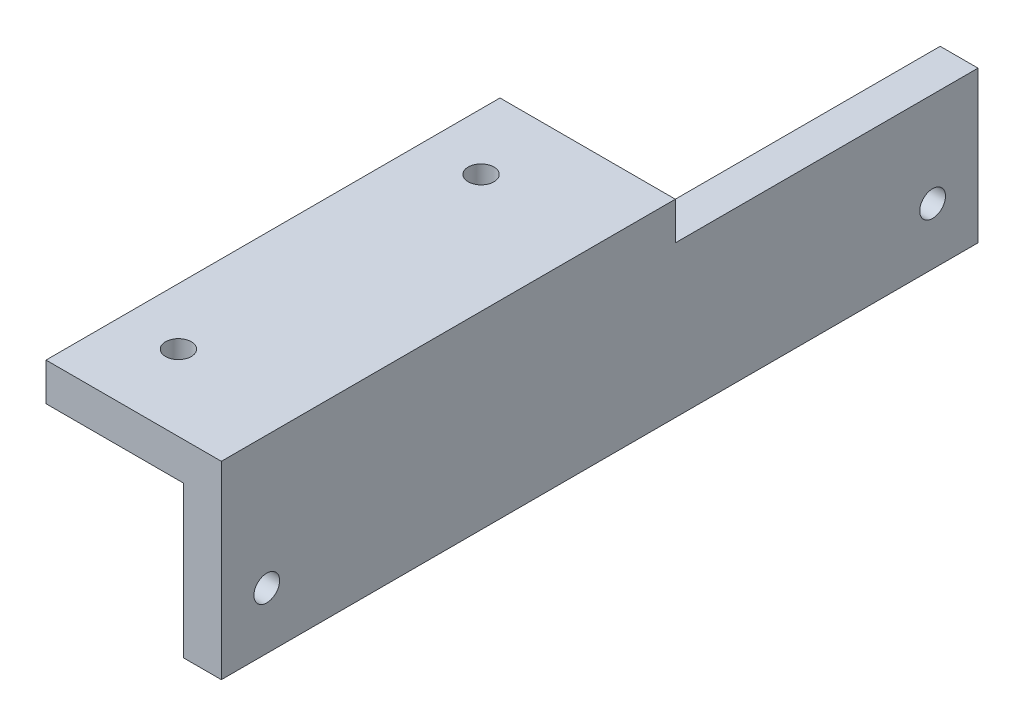
from build123d import *

# Parameters (mm, degrees)
SKETCH1_W           = 100
SKETCH1_H           = 20
SKETCH1_R           = 1.7
BOSS_EXTRUDE1_DEPTH = 2.5
SKETCH1_3_W         = 100
SKETCH1_3_H         = 20
BOSS_EXTRUDE2_DEPTH = 2.5
SKETCH2_W           = 23.175
SKETCH2_H           = 60
SKETCH2_R           = 1.7
BOSS_EXTRUDE3_DEPTH = 5


with BuildPart() as part:
    # Sketch1 → Boss-Extrude1 (new body)
    with BuildSketch(Plane(origin=(0, 0, 0), x_dir=(0, 0, -1), z_dir=(1, 0, 0))):
        with Locations((50, 10)):
            Rectangle(SKETCH1_W, SKETCH1_H)
        with Locations((94, 7.5)):
            Circle(SKETCH1_R, mode=Mode.SUBTRACT)
        with Locations((6, 7.5)):
            Circle(SKETCH1_R, mode=Mode.SUBTRACT)
    extrude(amount=BOSS_EXTRUDE1_DEPTH)

    # Sketch1<3> → Boss-Extrude2 (add)
    with BuildSketch(Plane(origin=(0, 0, 0), x_dir=(0, 0, -1), z_dir=(1, 0, 0))):
        with Locations((50, 10)):
            Rectangle(SKETCH1_3_W, SKETCH1_3_H)
        Polygon((92.383419246, 4.7), (90.766838493, 7.5), (92.383419246, 10.3), (95.616580754, 10.3), (97.233161507, 7.5), (95.616580754, 4.7), align=None, mode=Mode.SUBTRACT)
        Polygon((9.233161507, 7.5), (7.616580754, 4.7), (4.383419246, 4.7), (2.766838493, 7.5), (4.383419246, 10.3), (7.616580754, 10.3), align=None, mode=Mode.SUBTRACT)
    extrude(amount=-BOSS_EXTRUDE2_DEPTH)

    # Sketch2 → Boss-Extrude3 (add)
    with BuildSketch(Plane(origin=(0, 20, 0), x_dir=(1, 0, 0), z_dir=(0, 1, 0))):
        with Locations((-9.0875, 30)):
            Rectangle(SKETCH2_W, SKETCH2_H)
        with Locations((-13.175, 10)):
            Circle(SKETCH2_R, mode=Mode.SUBTRACT)
        with Locations((-13.175, 50)):
            Circle(SKETCH2_R, mode=Mode.SUBTRACT)
    extrude(amount=BOSS_EXTRUDE3_DEPTH)


solid = part.part
